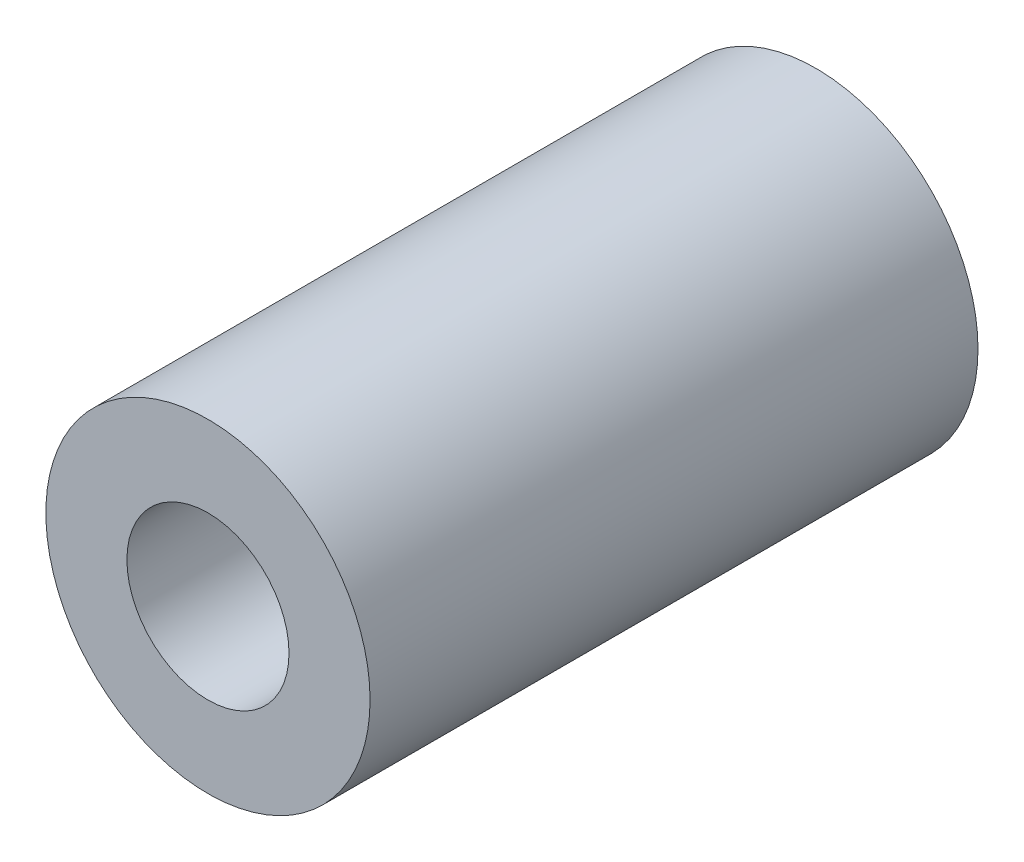
from build123d import *

# Parameters (mm, degrees)
SKETCH_1_R      = 0.04
SKETCH_1_R_2    = 0.02
EXTRUDE_1_DEPTH = 0.15


with BuildPart() as part:
    # 草圖1 → 填料-伸長1 (new body)
    with BuildSketch(Plane.XY):
        Circle(SKETCH_1_R)
        Circle(SKETCH_1_R_2, mode=Mode.SUBTRACT)
    extrude(amount=EXTRUDE_1_DEPTH)


solid = part.part
